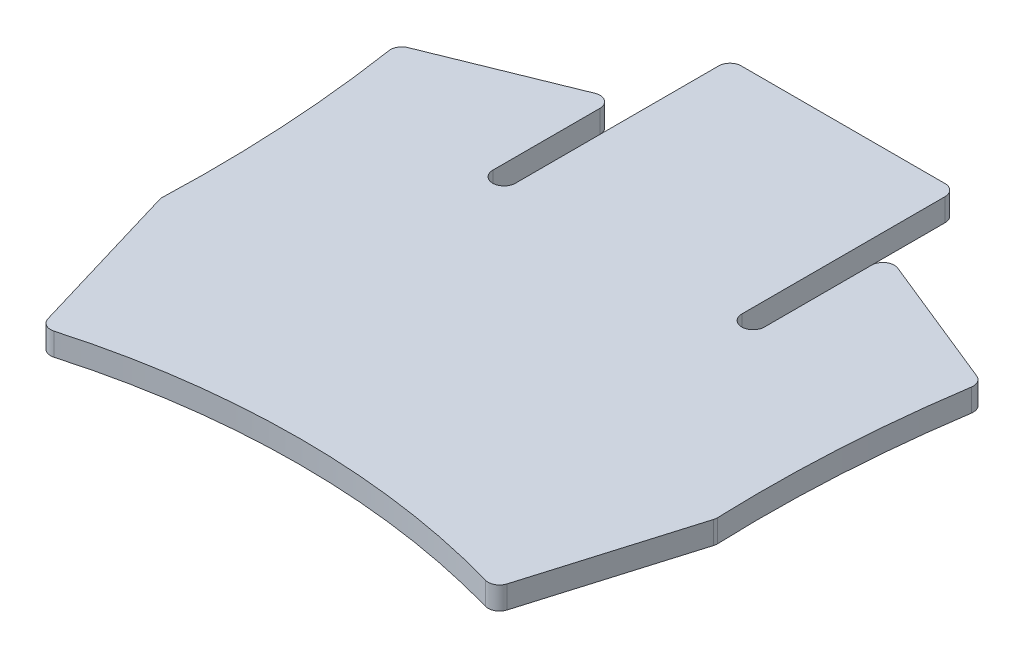
from build123d import *

# Parameters (mm, degrees)
RESSALTO_EXTRUS_O1_DEPTH = 2


with BuildPart() as part:
    # Esboço1 → Ressalto-extrusão1 (new body)
    with BuildSketch(Plane(origin=(0, 0, 0), x_dir=(1, 0, 0), z_dir=(0, 1, 0))):
        with BuildLine():
            Line((9, 21.44797145), (-9, 21.44797145))
            ThreePointArc((-9, 21.44797145), (-9.707106781, 21.155078231), (-10, 20.44797145))
            Line((-10, 20.44797145), (-10, 2.4935203))
            ThreePointArc((-10, 2.4935203), (-11, 1.4935203), (-12, 2.4935203))
            Line((-12, 2.4935203), (-12, 11.963556295))
            ThreePointArc((-12, 11.963556295), (-12.441287452, 12.792917669), (-13.375680577, 12.890305508))
            Line((-13.375680577, 12.890305508), (-25.118348649, 8.130126323))
            ThreePointArc((-25.118348649, 8.130126323), (-25.611934385, 7.697721197), (-25.731213115, 7.052450978))
            ThreePointArc((-25.731213115, 7.052450978), (-24.623016259, -3.51887647), (-24.513147024, -14.147563739))
            ThreePointArc((-24.513147024, -14.147563739), (-24.505828612, -14.310453824), (-24.472135955, -14.469989225))
            Line((-24.472135955, -14.469989225), (-20.283702113, -28.518423408))
            ThreePointArc((-20.283702113, -28.518423408), (-19.807170843, -29.108999363), (-19.053198713, -29.194953058))
            ThreePointArc((-19.053198713, -29.194953058), (-9.617814606, -27.215907789), (0, -26.55202855))
            ThreePointArc((0, -26.55202855), (9.617814606, -27.215907789), (19.053198713, -29.194953058))
            ThreePointArc((19.053198713, -29.194953058), (19.807170843, -29.108999363), (20.283702113, -28.518423408))
            Line((20.283702113, -28.518423408), (24.472135955, -14.469989225))
            ThreePointArc((24.472135955, -14.469989225), (24.505828612, -14.310453824), (24.513147024, -14.147563739))
            ThreePointArc((24.513147024, -14.147563739), (24.623016259, -3.51887647), (25.731213115, 7.052450978))
            ThreePointArc((25.731213115, 7.052450978), (25.611934385, 7.697721197), (25.118348649, 8.130126323))
            Line((25.118348649, 8.130126323), (13.375680577, 12.890305508))
            ThreePointArc((13.375680577, 12.890305508), (12.441287452, 12.792917669), (12, 11.963556295))
            Line((12, 11.963556295), (12, 2.4935203))
            ThreePointArc((12, 2.4935203), (11, 1.4935203), (10, 2.4935203))
            Line((10, 2.4935203), (10, 20.44797145))
            ThreePointArc((10, 20.44797145), (9.707106781, 21.155078231), (9, 21.44797145))
        make_face()
    extrude(amount=RESSALTO_EXTRUS_O1_DEPTH)


solid = part.part
